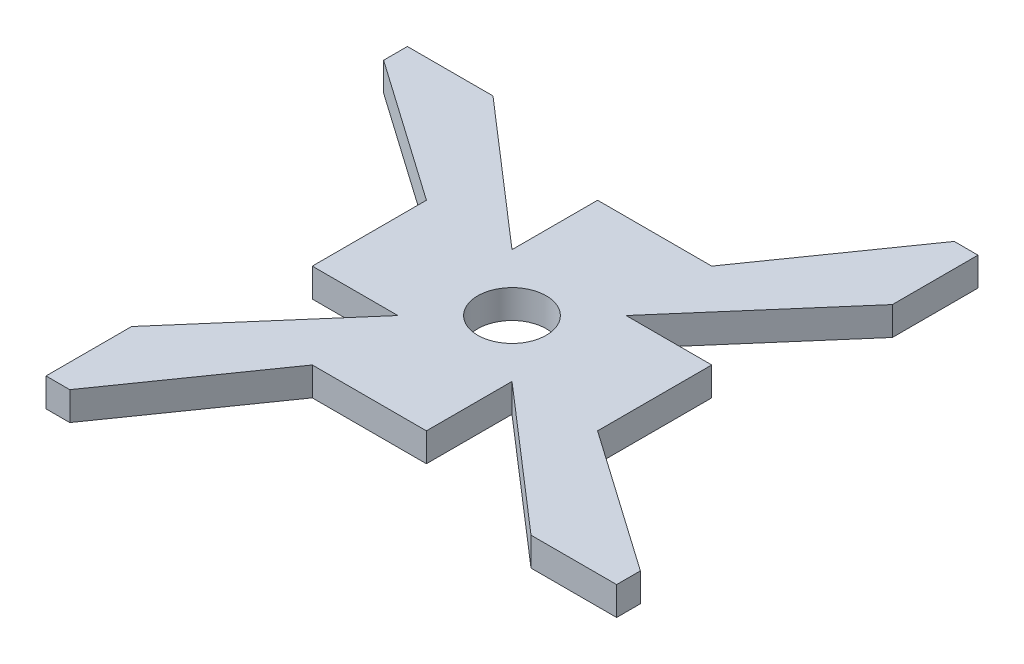
from build123d import *

# Parameters (mm, degrees)
SKETCH1_W           = 9
SKETCH1_H           = 2.5
SKETCH1_W_2         = 12
SKETCH1_H_2         = 9
SKETCH1_H_3         = 12
SKETCH1_R           = 3.6
SKETCH1_W_3         = 2.5
BOSS_EXTRUDE2_DEPTH = 3


with BuildPart() as part:
    # Sketch1 → Boss-Extrude2 (new body)
    # profile 1 of 13: a face of its own
    with BuildSketch(Plane(origin=(0, 0, 0), x_dir=(1, 0, 0), z_dir=(0, 1, 0))):
        Polygon((-6, 6), (-21, 19), (-21, 16.5), (-30, 16.5), (-15, 6), align=None)
    # profile 2 of 13: a face of its own
    with BuildSketch(Plane(origin=(0, 0, 0), x_dir=(1, 0, 0), z_dir=(0, 1, 0))):
        with Locations((-25.5, 17.75)):
            Rectangle(SKETCH1_W, SKETCH1_H)
    # profile 3 of 13: a face of its own
    with BuildSketch(Plane(origin=(0, 0, 0), x_dir=(1, 0, 0), z_dir=(0, 1, 0))):
        with Locations((0, 10.5)):
            Rectangle(SKETCH1_W_2, SKETCH1_H_2)
    # profile 4 of 13: a face of its own
    with BuildSketch(Plane(origin=(0, 0, 0), x_dir=(1, 0, 0), z_dir=(0, 1, 0))):
        with Locations((-10.5, 0)):
            Rectangle(SKETCH1_W, SKETCH1_H_3)
    # profile 5 of 13: a face of its own
    with BuildSketch(Plane(origin=(0, 0, 0), x_dir=(1, 0, 0), z_dir=(0, 1, 0))):
        Rectangle(SKETCH1_W_2, SKETCH1_H_3)
        with Locations(Location((0, 0, 0), (0, 0, 270))):
            Circle(SKETCH1_R, mode=Mode.SUBTRACT)
    # profile 6 of 13: a face of its own
    with BuildSketch(Plane(origin=(0, 0, 0), x_dir=(1, 0, 0), z_dir=(0, 1, 0))):
        with Locations((10.5, 0)):
            Rectangle(SKETCH1_W, SKETCH1_H_3)
    # profile 7 of 13: a face of its own
    with BuildSketch(Plane(origin=(0, 0, 0), x_dir=(1, 0, 0), z_dir=(0, 1, 0))):
        with Locations((0, -10.5)):
            Rectangle(SKETCH1_W_2, SKETCH1_H_2)
    # profile 8 of 13: a face of its own
    with BuildSketch(Plane(origin=(0, 0, 0), x_dir=(1, 0, 0), z_dir=(0, 1, 0))):
        Polygon((-6, -15), (-6, -6), (-19, -21), (-16.5, -21), (-16.5, -30), align=None)
    # profile 9 of 13: a face of its own
    with BuildSketch(Plane(origin=(0, 0, 0), x_dir=(1, 0, 0), z_dir=(0, 1, 0))):
        with Locations((-17.75, -25.5)):
            Rectangle(SKETCH1_W_3, SKETCH1_H_2)
    # profile 10 of 13: a face of its own
    with BuildSketch(Plane(origin=(0, 0, 0), x_dir=(1, 0, 0), z_dir=(0, 1, 0))):
        Polygon((15, -6), (6, -6), (21, -19), (21, -16.5), (30, -16.5), align=None)
    # profile 11 of 13: a face of its own
    with BuildSketch(Plane(origin=(0, 0, 0), x_dir=(1, 0, 0), z_dir=(0, 1, 0))):
        with Locations((25.5, -17.75)):
            Rectangle(SKETCH1_W, SKETCH1_H)
    # profile 12 of 13: a face of its own
    with BuildSketch(Plane(origin=(0, 0, 0), x_dir=(1, 0, 0), z_dir=(0, 1, 0))):
        Polygon((6, 15), (6, 6), (19, 21), (16.5, 21), (16.5, 30), align=None)
    # profile 13 of 13: a face of its own
    with BuildSketch(Plane(origin=(0, 0, 0), x_dir=(1, 0, 0), z_dir=(0, 1, 0))):
        with Locations((17.75, 25.5)):
            Rectangle(SKETCH1_W_3, SKETCH1_H_2)
    extrude(amount=BOSS_EXTRUDE2_DEPTH)


solid = part.part
